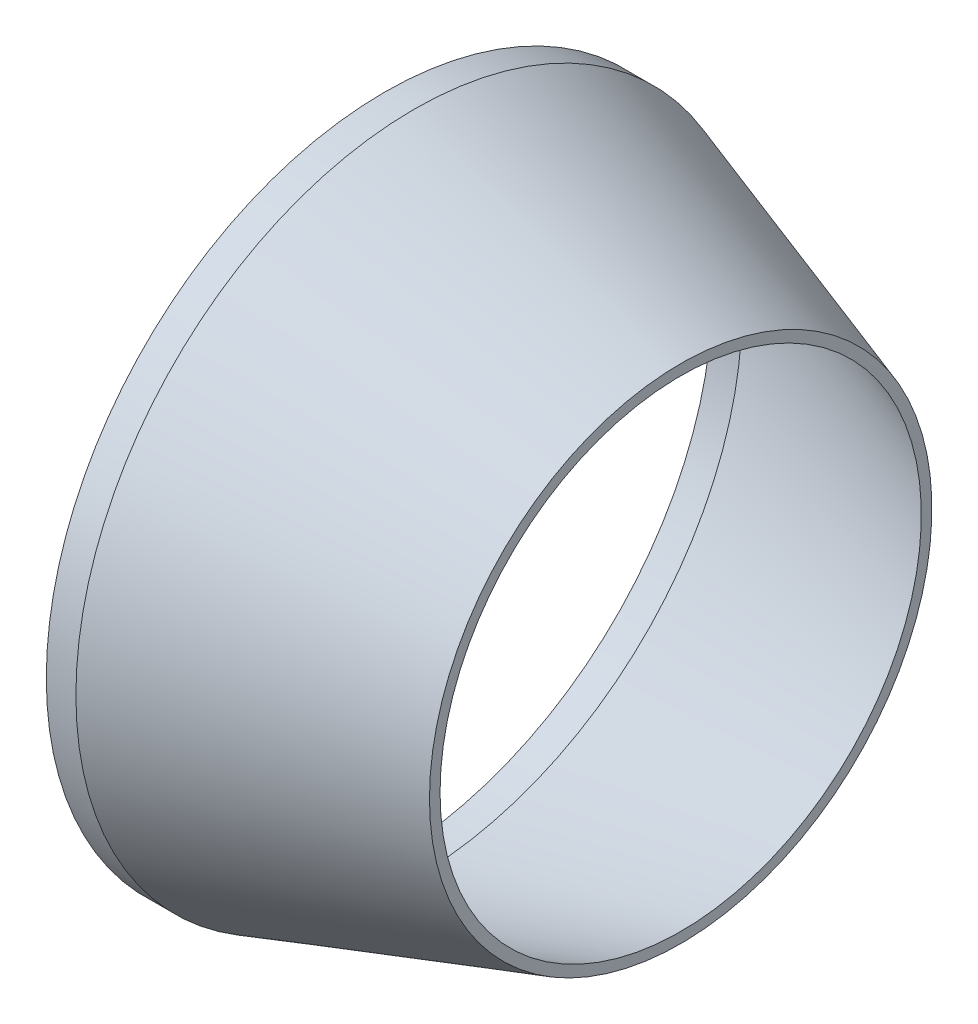
from build123d import *


with BuildPart() as part:
    # Sketch1 → Revolve1 (revolve)
    with BuildSketch(Plane.XY, mode=Mode.PRIVATE) as revolve1_sk:
        Polygon((0, 0), (0, 50.8), (4.445, 50.8), (44.45, 37.719), (44.45, 0), align=None)
    revolve(revolve1_sk.sketch.rotate(Axis((0, 0, 0), (1, 0, 0)), 90), axis=Axis((0, 0, 0), (1, 0, 0)))

    # Sketch5 → Cut-Revolve2 (revolve, cut)
    with BuildSketch(Plane.XY, mode=Mode.PRIVATE) as cut_revolve2_sk:
        Polygon((0, 0), (0, 49.2125), (4.445, 49.2125), (44.45, 36.1315), (44.45, 0), align=None)
    revolve(cut_revolve2_sk.sketch.rotate(Axis((0, 0, 0), (1, 0, 0)), 90), axis=Axis((0, 0, 0), (1, 0, 0)), mode=Mode.SUBTRACT)


solid = part.part
